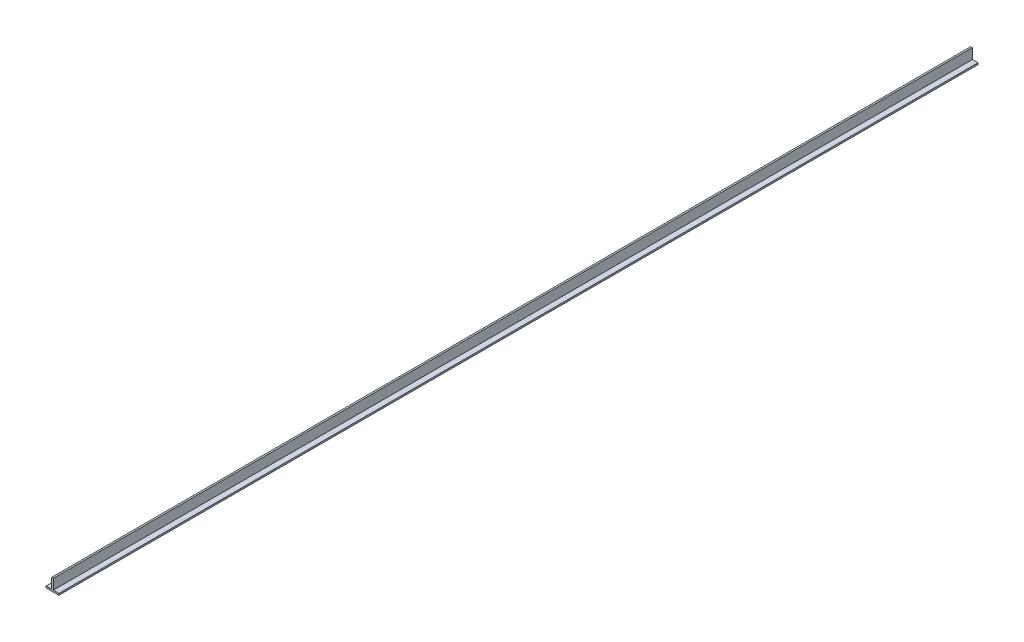
from build123d import *

# Parameters (mm, degrees)
BOSS_EXTRUDE1_DEPTH = 5000


with BuildPart() as part:
    # Sketch1 → Boss-Extrude1 (new body)
    with BuildSketch(Plane.XY):
        Polygon((4.5, 65), (-4.5, 65), (-4.5, 9), (-35, 9), (-35, 0), (35, 0), (35, 9), (4.5, 9), align=None)
    extrude(amount=BOSS_EXTRUDE1_DEPTH)


solid = part.part
